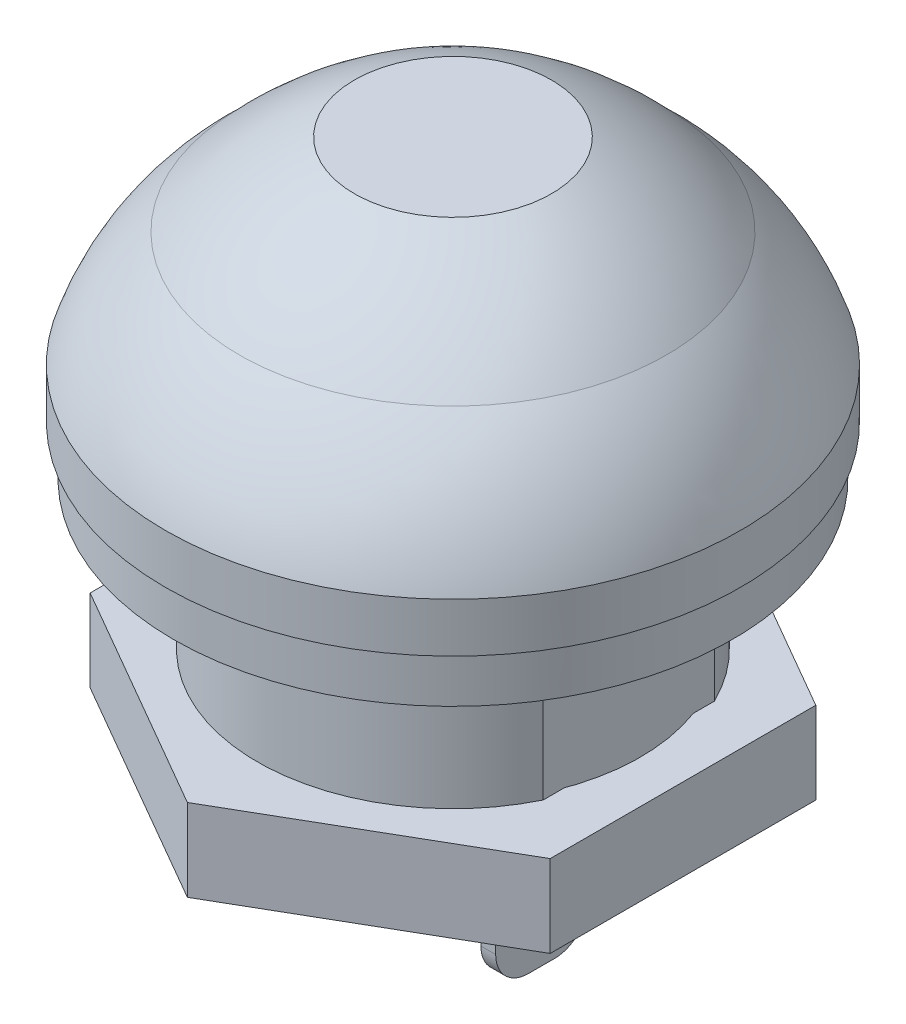
from build123d import *

# Parameters (mm, degrees)
BOSS_EXTRUDE1_DEPTH = 7
BOSS_EXTRUDE2_DEPTH = 1.5
SKETCH3_R           = 8.75
BOSS_EXTRUDE3_DEPTH = 1.5
SKETCH5_R           = 5.010854022
BOSS_EXTRUDE4_DEPTH = 1
SKETCH6_W           = 0.45
SKETCH6_H           = 2.8
BOSS_EXTRUDE5_DEPTH = 3.5
CUT_EXTRUDE1_DEPTH  = 19.436783994
FILLET1_R           = 1
SKETCH8_R           = 8.5
SKETCH8_R_2         = 7
BOSS_EXTRUDE6_DEPTH = 1.5
SKETCH9_R           = 5.7
BOSS_EXTRUDE7_DEPTH = 2.5


with BuildPart() as part:
    # Sketch1 → Boss-Extrude1 (new body)
    with BuildSketch(Plane(origin=(0, 0, 0), x_dir=(1, 0, 0), z_dir=(0, 1, 0))):
        with BuildLine():
            Line((-5.35, 2.603843313), (-5.35, -2.603843313))
            ThreePointArc((-5.35, -2.603843313), (0, -5.95), (5.35, -2.603843313))
            Line((5.35, -2.603843313), (5.35, 2.603843313))
            ThreePointArc((5.35, 2.603843313), (0, 5.95), (-5.35, 2.603843313))
        make_face()
    extrude(amount=-BOSS_EXTRUDE1_DEPTH)

    # Sketch2 → Boss-Extrude2 (add)
    with BuildSketch(Plane(origin=(0, 0, 0), x_dir=(1, 0, 0), z_dir=(0, 1, 0))):
        with BuildLine():
            Line((-2.754995463, -6.025), (2.754995463, -6.025))
            ThreePointArc((2.754995463, -6.025), (0, 6.625), (-2.754995463, -6.025))
        make_face()
    extrude(amount=BOSS_EXTRUDE2_DEPTH)

    # Sketch3 → Boss-Extrude3 (add)
    with BuildSketch(Plane(origin=(0, 1.5, 0), x_dir=(1, 0, 0), z_dir=(0, 1, 0))):
        with Locations(Location((0, 0, 0), (0, 0, 270))):
            Circle(SKETCH3_R)
    extrude(amount=BOSS_EXTRUDE3_DEPTH)

    # Sketch4 → Revolve2 (revolve)
    with BuildSketch(Plane.XY):
        with BuildLine():
            Line((0, 1.5), (0, 6.5))
            Line((0, 6.5), (0, 9))
            Line((0, 9), (-3, 9))
            ThreePointArc((-3, 9), (-4.886002476, 7.940403467), (-6.5, 6.5))
            ThreePointArc((-6.5, 6.5), (-7.856528253, 4.898839592), (-8.75, 3))
            Line((-8.75, 3), (-8.75, 1.5))
            Line((-8.75, 1.5), (0, 1.5))
        make_face()
    revolve(axis=Axis((0, 1.5, 0), (0, -1, 0)))

    # Sketch5 → Boss-Extrude4 (add)
    with BuildSketch(Plane.XZ.offset(7)):
        with Locations(Location((0, 0, 0), (0, 0, 90))):
            Circle(SKETCH5_R)
    extrude(amount=BOSS_EXTRUDE4_DEPTH)

    # Sketch6 → Boss-Extrude5 (add)
    with BuildSketch(Plane.XZ.offset(8)):
        with Locations((-2.475, 0)):
            Rectangle(SKETCH6_W, SKETCH6_H)
        with Locations((2.475, 0)):
            Rectangle(SKETCH6_W, SKETCH6_H)
    extrude(amount=BOSS_EXTRUDE5_DEPTH)

    # Sketch7 → Cut-Extrude1 (cut, through all)
    with BuildSketch(Plane(origin=(2.7, 0, 0), x_dir=(0, 0, -1), z_dir=(1, 0, 0))):
        with BuildLine():
            Line((0.6, -9.35), (0.6, -10.15))
            ThreePointArc((0.6, -10.15), (0, -10.75), (-0.6, -10.15))
            Line((-0.6, -10.15), (-0.6, -9.35))
            ThreePointArc((-0.6, -9.35), (0, -8.75), (0.6, -9.35))
        make_face()
    extrude(amount=-CUT_EXTRUDE1_DEPTH, mode=Mode.SUBTRACT)

    # Fillet1
    fillet1_edges = [part.edges().sort_by_distance(p)[0] for p in [
        (-2.475, -11.5, -1.4),
        (-2.475, -11.5, 1.4),
        (2.475, -11.5, 1.4),
        (2.475, -11.5, -1.4),
    ]]
    fillet(fillet1_edges, radius=FILLET1_R)

    # Sketch8 → Boss-Extrude6 (add)
    with BuildSketch(Plane.XZ.offset(-1.5)):
        with Locations(Location((0, 0, 0), (0, 0, 90))):
            Circle(SKETCH8_R)
        with Locations(Location((0, 0, 0), (0, 0, 270))):
            Circle(SKETCH8_R_2, mode=Mode.SUBTRACT)
    extrude(amount=BOSS_EXTRUDE6_DEPTH)


with BuildPart() as body_2:
    # Sketch9 → Boss-Extrude7 (new body)
    with BuildSketch(Plane.XZ.offset(7)):
        Polygon((0, -8.082903769), (7, -4.041451884), (7, 4.041451884), (0, 8.082903769), (-7, 4.041451884), (-7, -4.041451884), align=None)
        with Locations(Location((0, 0, 0), (0, 0, 270))):
            Circle(SKETCH9_R, mode=Mode.SUBTRACT)
    extrude(amount=-BOSS_EXTRUDE7_DEPTH)


solid = Compound([part.part, body_2.part])
